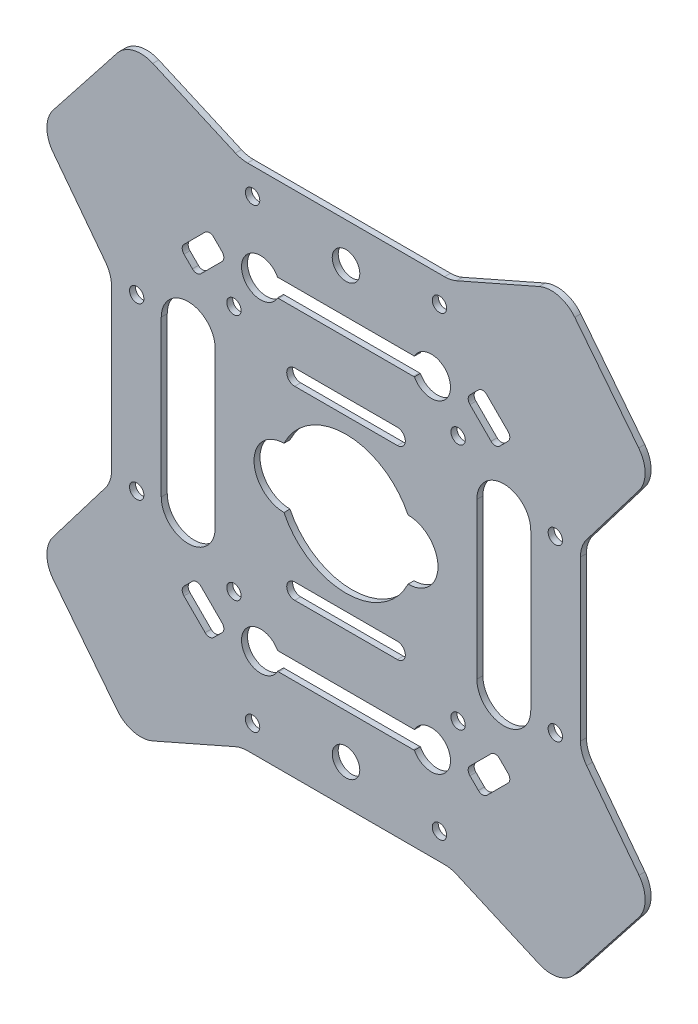
from build123d import *

# Parameters (mm, degrees)
BOSS_EXTRUDE1_DEPTH = 1
FILLET1_R           = 5
SKETCH3_R           = 3.2
CUT_EXTRUDE1_DEPTH  = 1
SKETCH5_R           = 2.3
SKETCH5_R_2         = 1.2
CUT_EXTRUDE2_DEPTH  = 1


with BuildPart() as part:
    # Sketch1 → Boss-Extrude1 (new body)
    with BuildSketch(Plane.XY):
        Polygon((-17.5, 42.5), (17.5, 42.5), (35.808239588, 50.550364165), (51.272978941, 30.907507022), (39.150635095, 15), (39.150635095, -15), (51.272978941, -30.907507022), (35.808239588, -50.550364165), (17.5, -42.5), (-17.5, -42.5), (-35.808239588, -50.550364165), (-51.272978941, -30.907507022), (-39.150635095, -15), (-39.150635095, 15), (-51.272978941, 30.907507022), (-35.808239588, 50.550364165), align=None)
    extrude(amount=BOSS_EXTRUDE1_DEPTH)

    # Fillet1
    fillet1_edges = [part.edges().sort_by_distance(p)[0] for p in [
        (-17.5, 42.5, 0.5),
        (17.5, 42.5, 0.5),
        (35.808239588, 50.550364165, 0.5),
        (51.272978941, 30.907507022, 0.5),
        (39.150635095, 15, 0.5),
        (39.150635095, -15, 0.5),
        (51.272978941, -30.907507022, 0.5),
        (35.808239588, -50.550364165, 0.5),
        (17.5, -42.5, 0.5),
        (-17.5, -42.5, 0.5),
        (-35.808239588, -50.550364165, 0.5),
        (-51.272978941, -30.907507022, 0.5),
        (-39.150635095, -15, 0.5),
        (-39.150635095, 15, 0.5),
        (-51.272978941, 30.907507022, 0.5),
        (-35.808239588, 50.550364165, 0.5),
    ]]
    fillet(fillet1_edges, radius=FILLET1_R)

    # Sketch3 → Cut-Extrude1 (cut)
    with BuildSketch(Plane.XY.offset(1)):
        with BuildLine():
            Line((-30.850635095, 13), (-30.850635095, -13))
            ThreePointArc((-30.850635095, -13), (-26.350635095, -17.5), (-21.850635095, -13))
            Line((-21.850635095, -13), (-21.850635095, 13))
            ThreePointArc((-21.850635095, 13), (-26.350635095, 17.5), (-30.850635095, 13))
        make_face()
        with BuildLine():
            Line((-27.057741876, 25.421320344), (-23.52220797, 28.956854249))
            ThreePointArc((-23.52220797, 28.956854249), (-22.815101189, 29.249747468), (-22.107994407, 28.956854249))
            Line((-22.107994407, 28.956854249), (-20.693780845, 27.542640687))
            ThreePointArc((-20.693780845, 27.542640687), (-20.400887626, 26.835533906), (-20.693780845, 26.128427125))
            Line((-20.693780845, 26.128427125), (-24.229314751, 22.592893219))
            ThreePointArc((-24.229314751, 22.592893219), (-24.936421532, 22.3), (-25.643528313, 22.592893219))
            Line((-25.643528313, 22.592893219), (-27.057741876, 24.007106781))
            ThreePointArc((-27.057741876, 24.007106781), (-27.350635095, 24.714213562), (-27.057741876, 25.421320344))
        make_face()
        with BuildLine():
            ThreePointArc((-11.418333333, 28.490524703), (-12.75, 27), (-11.418333333, 25.509475297))
            ThreePointArc((-11.418333333, 25.509475297), (-11.143447785, 26.232319511), (-11.05, 27))
            ThreePointArc((-11.05, 27), (-11.143447785, 27.767680489), (-11.418333333, 28.490524703))
        make_face()
        with BuildLine():
            ThreePointArc((-11.418333333, 28.490524703), (-17.45, 27), (-11.418333333, 25.509475297))
            ThreePointArc((-11.418333333, 25.509475297), (-12.75, 27), (-11.418333333, 28.490524703))
        make_face()
        with BuildLine():
            ThreePointArc((11.418333333, 28.490524703), (12.75, 27), (11.418333333, 25.509475297))
            ThreePointArc((11.418333333, 25.509475297), (15.017680489, 23.893447785), (17.45, 27))
            ThreePointArc((17.45, 27), (15.017680489, 30.106552215), (11.418333333, 28.490524703))
        make_face()
        with BuildLine():
            ThreePointArc((11.418333333, 28.490524703), (11.05, 27), (11.418333333, 25.509475297))
            ThreePointArc((11.418333333, 25.509475297), (12.75, 27), (11.418333333, 28.490524703))
        make_face()
        with Locations((14.25, 27)):
            Circle(SKETCH3_R)
        with Locations((-14.25, 27)):
            Circle(SKETCH3_R)
        with BuildLine():
            ThreePointArc((11.25, 28.5), (12.75, 27), (11.25, 25.5))
            Line((11.25, 25.5), (-11.25, 25.5))
            ThreePointArc((-11.25, 25.5), (-12.75, 27), (-11.25, 28.5))
            Line((-11.25, 28.5), (11.25, 28.5))
        make_face()
        with BuildLine():
            Line((20.693780845, 26.128427125), (24.229314751, 22.592893219))
            ThreePointArc((24.229314751, 22.592893219), (24.936421532, 22.3), (25.643528313, 22.592893219))
            Line((25.643528313, 22.592893219), (27.057741876, 24.007106781))
            ThreePointArc((27.057741876, 24.007106781), (27.350635095, 24.714213562), (27.057741876, 25.421320344))
            Line((27.057741876, 25.421320344), (23.52220797, 28.956854249))
            ThreePointArc((23.52220797, 28.956854249), (22.815101189, 29.249747468), (22.107994407, 28.956854249))
            Line((22.107994407, 28.956854249), (20.693780845, 27.542640687))
            ThreePointArc((20.693780845, 27.542640687), (20.400887626, 26.835533906), (20.693780845, 26.128427125))
        make_face()
        with BuildLine():
            ThreePointArc((30.850635095, -13), (26.350635095, -17.5), (21.850635095, -13))
            Line((21.850635095, -13), (21.850635095, 13))
            ThreePointArc((21.850635095, 13), (26.350635095, 17.5), (30.850635095, 13))
            Line((30.850635095, 13), (30.850635095, -13))
        make_face()
        with BuildLine():
            ThreePointArc((8.575, 16.8), (9.9, 15.475), (8.575, 14.15))
            Line((8.575, 14.15), (-8.575, 14.15))
            ThreePointArc((-8.575, 14.15), (-9.9, 15.475), (-8.575, 16.8))
            Line((-8.575, 16.8), (8.575, 16.8))
        make_face()
        with BuildLine():
            ThreePointArc((10.356157589, 5), (0, 11.5), (-10.356157589, 5))
            Line((-10.356157589, 5), (10.356157589, 5))
        make_face()
        with BuildLine():
            Line((10.356157589, 5), (-10.356157589, 5))
            ThreePointArc((-10.356157589, 5), (-11.5, 0), (-10.356157589, -5))
            Line((-10.356157589, -5), (10.356157589, -5))
            ThreePointArc((10.356157589, -5), (11.210392773, -2.564584541), (11.5, 0))
            ThreePointArc((11.5, 0), (11.210392773, 2.564584541), (10.356157589, 5))
        make_face()
        with BuildLine():
            ThreePointArc((10.356157589, -5), (15.356157589, 0), (10.356157589, 5))
            ThreePointArc((10.356157589, 5), (11.210392773, 2.564584541), (11.5, 0))
            ThreePointArc((11.5, 0), (11.210392773, -2.564584541), (10.356157589, -5))
        make_face()
        with BuildLine():
            Line((10.356157589, -5), (-10.356157589, -5))
            ThreePointArc((-10.356157589, -5), (0, -11.5), (10.356157589, -5))
        make_face()
        with BuildLine():
            ThreePointArc((-10.356157589, -5), (-11.5, 0), (-10.356157589, 5))
            ThreePointArc((-10.356157589, 5), (-15.356157589, 0), (-10.356157589, -5))
        make_face()
        with Locations((14.25, -27)):
            Circle(SKETCH3_R)
        with Locations((-14.25, -27)):
            Circle(SKETCH3_R)
        with BuildLine():
            ThreePointArc((11.25, -28.5), (12.75, -27), (11.25, -25.5))
            Line((11.25, -25.5), (-11.25, -25.5))
            ThreePointArc((-11.25, -25.5), (-12.75, -27), (-11.25, -28.5))
            Line((-11.25, -28.5), (11.25, -28.5))
        make_face()
        with BuildLine():
            Line((-8.575, -16.8), (8.575, -16.8))
            ThreePointArc((8.575, -16.8), (9.9, -15.475), (8.575, -14.15))
            Line((8.575, -14.15), (-8.575, -14.15))
            ThreePointArc((-8.575, -14.15), (-9.9, -15.475), (-8.575, -16.8))
        make_face()
        with BuildLine():
            ThreePointArc((17.45, -27), (15.017680489, -23.893447785), (11.418333333, -25.509475297))
            ThreePointArc((11.418333333, -25.509475297), (12.75, -27), (11.418333333, -28.490524703))
            ThreePointArc((11.418333333, -28.490524703), (15.017680489, -30.106552215), (17.45, -27))
        make_face()
        with BuildLine():
            ThreePointArc((11.418333333, -28.490524703), (12.75, -27), (11.418333333, -25.509475297))
            ThreePointArc((11.418333333, -25.509475297), (11.05, -27), (11.418333333, -28.490524703))
        make_face()
        with BuildLine():
            ThreePointArc((-11.05, -27), (-11.143447785, -26.232319511), (-11.418333333, -25.509475297))
            ThreePointArc((-11.418333333, -25.509475297), (-12.75, -27), (-11.418333333, -28.490524703))
            ThreePointArc((-11.418333333, -28.490524703), (-11.143447785, -27.767680489), (-11.05, -27))
        make_face()
        with BuildLine():
            ThreePointArc((-11.418333333, -28.490524703), (-12.75, -27), (-11.418333333, -25.509475297))
            ThreePointArc((-11.418333333, -25.509475297), (-17.45, -27), (-11.418333333, -28.490524703))
        make_face()
        with BuildLine():
            Line((-20.693780845, -26.128427125), (-24.229314751, -22.592893219))
            ThreePointArc((-24.229314751, -22.592893219), (-24.936421532, -22.3), (-25.643528313, -22.592893219))
            Line((-25.643528313, -22.592893219), (-27.057741876, -24.007106781))
            ThreePointArc((-27.057741876, -24.007106781), (-27.350635095, -24.714213562), (-27.057741876, -25.421320344))
            Line((-27.057741876, -25.421320344), (-23.52220797, -28.956854249))
            ThreePointArc((-23.52220797, -28.956854249), (-22.815101189, -29.249747468), (-22.107994407, -28.956854249))
            Line((-22.107994407, -28.956854249), (-20.693780845, -27.542640687))
            ThreePointArc((-20.693780845, -27.542640687), (-20.400887626, -26.835533906), (-20.693780845, -26.128427125))
        make_face()
        with BuildLine():
            Line((27.057741876, -25.421320344), (23.52220797, -28.956854249))
            ThreePointArc((23.52220797, -28.956854249), (22.815101189, -29.249747468), (22.107994407, -28.956854249))
            Line((22.107994407, -28.956854249), (20.693780845, -27.542640687))
            ThreePointArc((20.693780845, -27.542640687), (20.400887626, -26.835533906), (20.693780845, -26.128427125))
            Line((20.693780845, -26.128427125), (24.229314751, -22.592893219))
            ThreePointArc((24.229314751, -22.592893219), (24.936421532, -22.3), (25.643528313, -22.592893219))
            Line((25.643528313, -22.592893219), (27.057741876, -24.007106781))
            ThreePointArc((27.057741876, -24.007106781), (27.350635095, -24.714213562), (27.057741876, -25.421320344))
        make_face()
    extrude(amount=-CUT_EXTRUDE1_DEPTH, mode=Mode.SUBTRACT)

    # Sketch5 → Cut-Extrude2 (cut)
    with BuildSketch(Plane.XY.offset(1)):
        with Locations((0, -35.9)):
            Circle(SKETCH5_R)
        with Locations((-15.6, -38.1)):
            Circle(SKETCH5_R_2)
        with Locations(Location((15.6, -38.1, 0), (0, 0, 180))):
            Circle(SKETCH5_R_2)
        with Locations((18.713881858, -20.612994231)):
            Circle(SKETCH5_R_2)
        with Locations((34.950635095, -14.2)):
            Circle(SKETCH5_R_2)
        with Locations(Location((34.950635095, 14.2, 0), (0, 0, 180))):
            Circle(SKETCH5_R_2)
        with Locations((-34.950635095, 14.2)):
            Circle(SKETCH5_R_2)
        with Locations(Location((-34.950635095, -14.2, 0), (0, 0, 180))):
            Circle(SKETCH5_R_2)
        with Locations((15.6, 38.1)):
            Circle(SKETCH5_R_2)
        with Locations(Location((0, 35.9, 0), (0, 0, 180))):
            Circle(SKETCH5_R)
        with Locations(Location((-15.6, 38.1, 0), (0, 0, 180))):
            Circle(SKETCH5_R_2)
        with Locations(Location((-18.713881858, -20.612994231, 0), (0, 0, 180))):
            Circle(SKETCH5_R_2)
        with Locations(Location((18.713881858, 20.612994231, 0), (0, 0, 180))):
            Circle(SKETCH5_R_2)
        with Locations((-18.713881858, 20.612994231)):
            Circle(SKETCH5_R_2)
    extrude(amount=-CUT_EXTRUDE2_DEPTH, mode=Mode.SUBTRACT)


solid = part.part
